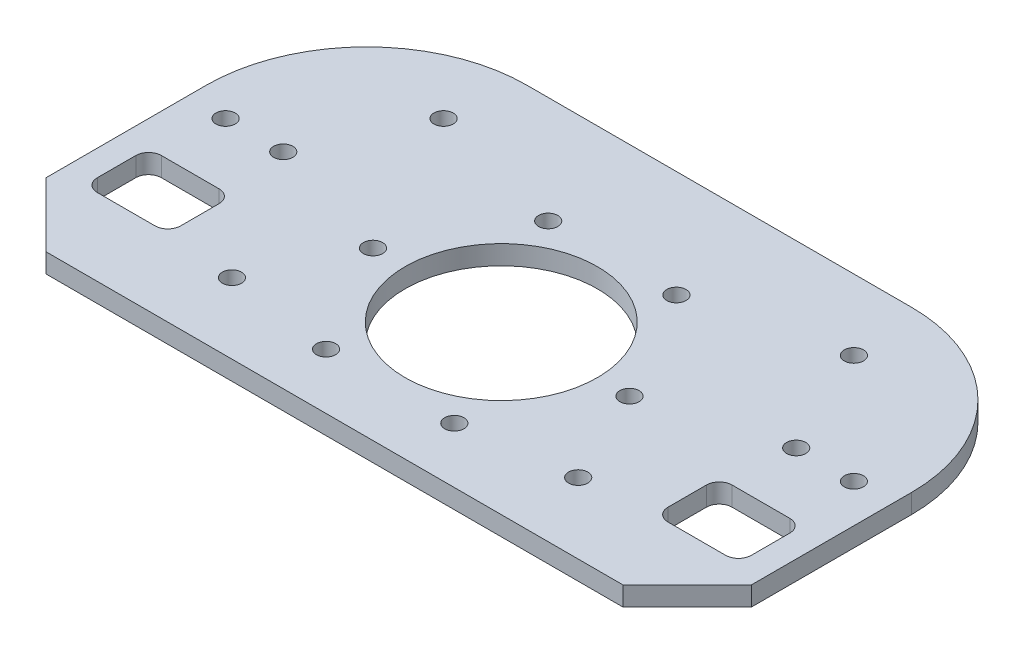
from build123d import *

# Parameters (mm, degrees)
SKETCH_1_W          = 110
SKETCH_1_H          = 60
SKETCH_1_R          = 1.5
EXTRUDE_1_DEPTH     = 3
FILLET_1_R          = 25
CHAMFER_1_SIZE      = 10
SKETCH_3_R          = 1.5
CUT_EXTRUDE_2_DEPTH = 3
SKETCH_4_W          = 13
SKETCH_4_H          = 10
CUT_EXTRUDE_3_DEPTH = 10
FILLET_2_R          = 2
SKETCH_5_R          = 1.5
SKETCH_5_R_2        = 15
CUT_EXTRUDE_4_DEPTH = 3


with BuildPart() as part:
    # 草图1 → 凸台-拉伸1 (new body)
    with BuildSketch(Plane(origin=(0, 0, 0), x_dir=(1, 0, 0), z_dir=(0, 1, 0))):
        Rectangle(SKETCH_1_W, SKETCH_1_H)
        with Locations(Location((-49, 2, 0), (0, 0, 270))):
            Circle(SKETCH_1_R, mode=Mode.SUBTRACT)
        with Locations(Location((-40, 2, 0), (0, 0, 270))):
            Circle(SKETCH_1_R, mode=Mode.SUBTRACT)
        with Locations(Location((49, 2, 0), (0, 0, 90))):
            Circle(SKETCH_1_R, mode=Mode.SUBTRACT)
        with Locations(Location((40, 2, 0), (0, 0, 90))):
            Circle(SKETCH_1_R, mode=Mode.SUBTRACT)
    extrude(amount=EXTRUDE_1_DEPTH)

    # 圆角1
    fillet_1_edges = [part.edges().sort_by_distance(p)[0] for p in [
        (-55, 1.5, -30),
        (55, 1.5, -30),
    ]]
    fillet(fillet_1_edges, radius=FILLET_1_R)

    # 倒角1
    chamfer_1_edges = [part.edges().sort_by_distance(p)[0] for p in [
        (55, 1.5, 30),
        (-55, 1.5, 30),
    ]]
    chamfer(chamfer_1_edges, length=CHAMFER_1_SIZE)

    # 草图3 → 切除-拉伸2 (cut)
    with BuildSketch(Plane(origin=(0, 3, 0), x_dir=(1, 0, 0), z_dir=(0, 1, 0))):
        with Locations(Location((-32, 19, 0), (0, 0, 270))):
            Circle(SKETCH_3_R)
        with Locations(Location((-27, -19, 0), (0, 0, 270))):
            Circle(SKETCH_3_R)
        with Locations(Location((27, -19, 0), (0, 0, 90))):
            Circle(SKETCH_3_R)
        with Locations(Location((32, 19, 0), (0, 0, 90))):
            Circle(SKETCH_3_R)
    extrude(amount=-CUT_EXTRUDE_2_DEPTH, mode=Mode.SUBTRACT)

    # 草图4 → 切除-拉伸3 (cut)
    with BuildSketch(Plane(origin=(0, 3, 0), x_dir=(1, 0, 0), z_dir=(0, 1, 0))):
        with Locations((-44.5, -13)):
            Rectangle(SKETCH_4_W, SKETCH_4_H)
        with Locations((44.5, -13)):
            Rectangle(SKETCH_4_W, SKETCH_4_H)
    extrude(amount=-CUT_EXTRUDE_3_DEPTH, mode=Mode.SUBTRACT)

    # 圆角2
    fillet_2_edges = [part.edges().sort_by_distance(p)[0] for p in [
        (-38, 1.5, 8),
        (-38, 1.5, 18),
        (-51, 1.5, 18),
        (-51, 1.5, 8),
        (51, 1.5, 8),
        (51, 1.5, 18),
        (38, 1.5, 18),
        (38, 1.5, 8),
    ]]
    fillet(fillet_2_edges, radius=FILLET_2_R)

    # 草图5 → 切除-拉伸4 (cut)
    with BuildSketch(Plane(origin=(0, 3, 0), x_dir=(1, 0, 0), z_dir=(0, 1, 0))):
        with Locations(Location((20, -4, 0), (0, 0, 270))):
            Circle(SKETCH_5_R)
        with Locations(Location((10, 13.320508076, 0), (0, 0, 270))):
            Circle(SKETCH_5_R)
        with Locations(Location((-20, -4, 0), (0, 0, 90))):
            Circle(SKETCH_5_R)
        with Locations(Location((-10, 13.320508076, 0), (0, 0, 90))):
            Circle(SKETCH_5_R)
        with Locations(Location((10, -21.320508076, 0), (0, 0, 90))):
            Circle(SKETCH_5_R)
        with Locations(Location((-10, -21.320508076, 0), (0, 0, 270))):
            Circle(SKETCH_5_R)
        with Locations(Location((0, -4, 0), (0, 0, 270))):
            Circle(SKETCH_5_R_2)
    extrude(amount=-CUT_EXTRUDE_4_DEPTH, mode=Mode.SUBTRACT)


solid = part.part
